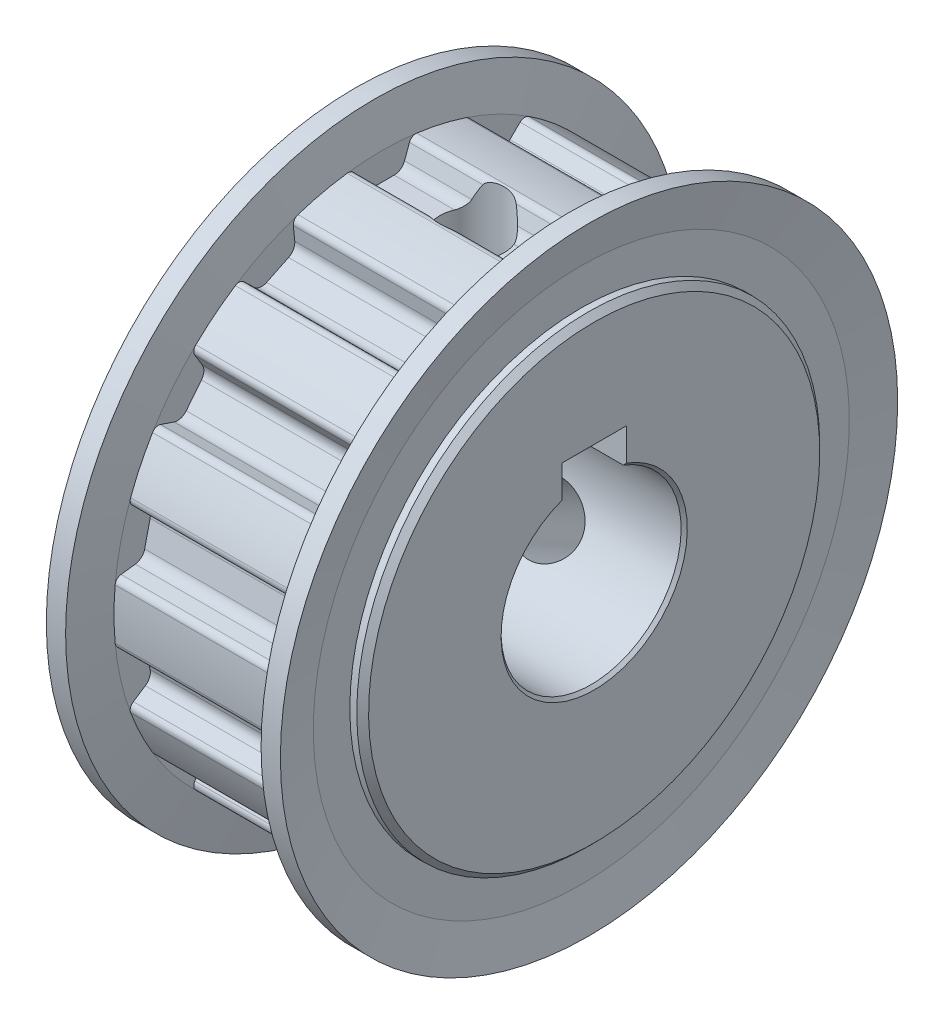
from build123d import *

# Parameters (mm, degrees)
CUT_EXTRUDE_START        = 16.5
CUT_EXTRUDE_1_DEPTH      = 14
PATTERN_CIRCULAR_1_COUNT = 14
SKETCH_6_R               = 7
CUT_EXTRUDE_2_DEPTH      = 39.897300678
CHAMFER_1_SIZE           = 0.24
SKETCH_7_W               = 5
SKETCH_7_H               = 2.761651585
CUT_EXTRUDE_1_2_DEPTH    = 19
SKETCH_11_W              = 2.5
SKETCH_11_H              = 20.84
PATTERN_CIRCULAR_2_COUNT = 2
PATTERN_CIRCULAR_2_ANGLE = 120


with BuildPart() as part:
    # 草图3 → 旋转1 (revolve)
    with BuildSketch(Plane.XY):
        Polygon((0, 0), (0, 17.54), (0.46, 18), (2.5, 18), (2.5, 20.84), (16.5, 20.84), (16.5, 18), (18.54, 18), (19, 17.54), (19, 0), align=None)
    revolve(axis=Axis((19, 0, 0), (-1, 0, 0)))

    # 草图4 → Cut-Extrude 1 (cut)
    with BuildSketch(Plane(origin=(0, 0, 0), x_dir=(0, 0, -1), z_dir=(1, 0, 0)).offset(CUT_EXTRUDE_START)):
        with BuildLine():
            Line((-0.947821517, 18.71), (0.947821517, 18.71))
            ThreePointArc((0.947821517, 18.71), (1.441097252, 18.865529242), (1.755957171, 19.275862677))
            Line((1.755957171, 19.275862677), (2.135902122, 20.319752849))
            ThreePointArc((2.135902122, 20.319752849), (2.358797616, 20.591469041), (2.702673222, 20.664006326))
            ThreePointArc((2.702673222, 20.664006326), (0, 20.84), (-2.702673222, 20.664006326))
            ThreePointArc((-2.702673222, 20.664006326), (-2.358797616, 20.591469041), (-2.135902122, 20.319752849))
            Line((-2.135902122, 20.319752849), (-1.755957171, 19.275862677))
            ThreePointArc((-1.755957171, 19.275862677), (-1.441097252, 18.865529242), (-0.947821517, 18.71))
        make_face()
    cut_extrude_1 = extrude(amount=-CUT_EXTRUDE_1_DEPTH, mode=Mode.SUBTRACT)

    # 阵列(圆周)1: Cut-Extrude 1 ×14 about axis
    pattern_circular_1_axis = Axis((0, 0, 0), (1, 0, 0))
    for i in range(1, PATTERN_CIRCULAR_1_COUNT):
        add(cut_extrude_1.rotate(pattern_circular_1_axis, i * 360 / PATTERN_CIRCULAR_1_COUNT), mode=Mode.SUBTRACT)

    # 草图5 → 旋转2 (revolve)
    with BuildSketch(Plane.XY, mode=Mode.PRIVATE) as revolve_2_sk:
        Polygon((1.9, 24), (2.5, 20.84), (2.5, 18), (1, 18), (1, 20.84), (0.4, 24), align=None)
        Polygon((18, 18), (16.5, 18), (16.5, 20.84), (17.1, 24), (18.6, 24), (18, 20.84), align=None)
    revolve(revolve_2_sk.sketch.rotate(Axis((0, 0, 0), (1, 0, 0)), 180), axis=Axis((0, 0, 0), (1, 0, 0)))

    # 草图6 → 切除-拉伸2 (cut, through all)
    with BuildSketch(Plane(origin=(0, 0, 0), x_dir=(0, 0, -1), z_dir=(1, 0, 0))):
        Circle(SKETCH_6_R)
    extrude(amount=CUT_EXTRUDE_2_DEPTH, mode=Mode.SUBTRACT)

    # 倒角1
    chamfer_1_edges = [part.edges().sort_by_distance(p)[0] for p in [
        (0, 0, 7),
        (19, 0, 7),
    ]]
    chamfer(chamfer_1_edges, length=CHAMFER_1_SIZE)

    # 草图7 → Cut-Extrude 1 2 (cut)
    with BuildSketch(Plane(origin=(0, 0, 0), x_dir=(0, 0, -1), z_dir=(1, 0, 0))):
        with Locations((0, 7.919174208)):
            Rectangle(SKETCH_7_W, SKETCH_7_H)
    extrude(amount=CUT_EXTRUDE_1_2_DEPTH, mode=Mode.SUBTRACT)

    # 草图11 → 切除-旋转5 (revolve, cut)
    with BuildSketch(Plane.XY, mode=Mode.PRIVATE) as cut_revolve_5_sk:
        with Locations((10.75, 10.42)):
            Rectangle(SKETCH_11_W, SKETCH_11_H)
    cut_revolve_5 = revolve(cut_revolve_5_sk.sketch.rotate(Axis((9.5, 20.84, 0), (0, -1, 0)), 157.720282995), axis=Axis((9.5, 20.84, 0), (0, -1, 0)), mode=Mode.SUBTRACT)

    # 阵列(圆周)2: 切除-旋转5 ×2 about axis
    pattern_circular_2_axis = Axis((19, 0, 0), (-1, 0, 0))
    for i in range(1, PATTERN_CIRCULAR_2_COUNT):
        add(cut_revolve_5.rotate(pattern_circular_2_axis, i * PATTERN_CIRCULAR_2_ANGLE / (PATTERN_CIRCULAR_2_COUNT - 1)), mode=Mode.SUBTRACT)


solid = part.part
